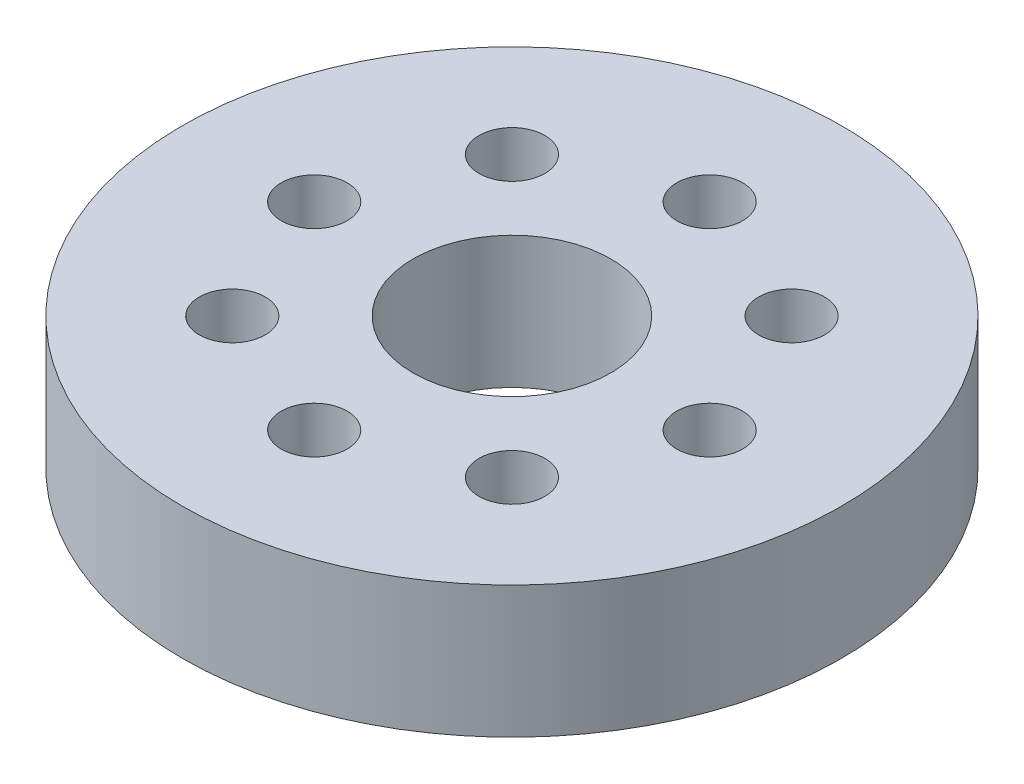
from build123d import *

# Parameters (mm, degrees)
SKETCH2_R           = 10
SKETCH2_R_2         = 3
SKETCH2_R_3         = 1
BOSS_EXTRUDE1_DEPTH = 4


with BuildPart() as part:
    # Sketch2 → Boss-Extrude1 (new body)
    with BuildSketch(Plane(origin=(0, 0, 0), x_dir=(1, 0, 0), z_dir=(0, 1, 0))):
        with Locations(Location((0, 0, 0), (0, 0, 270))):
            Circle(SKETCH2_R)
        with Locations(Location((0, 0, 0), (0, 0, 270))):
            Circle(SKETCH2_R_2, mode=Mode.SUBTRACT)
        with Locations(Location((0, 6, 0), (0, 0, 270))):
            Circle(SKETCH2_R_3, mode=Mode.SUBTRACT)
        with Locations(Location((4.242640687, 4.242640687, 0), (0, 0, 270))):
            Circle(SKETCH2_R_3, mode=Mode.SUBTRACT)
        with Locations(Location((6, 0, 0), (0, 0, 270))):
            Circle(SKETCH2_R_3, mode=Mode.SUBTRACT)
        with Locations(Location((4.242640687, -4.242640687, 0), (0, 0, 270))):
            Circle(SKETCH2_R_3, mode=Mode.SUBTRACT)
        with Locations(Location((0, -6, 0), (0, 0, 270))):
            Circle(SKETCH2_R_3, mode=Mode.SUBTRACT)
        with Locations(Location((-4.242640687, -4.242640687, 0), (0, 0, 270))):
            Circle(SKETCH2_R_3, mode=Mode.SUBTRACT)
        with Locations(Location((-6, 0, 0), (0, 0, 270))):
            Circle(SKETCH2_R_3, mode=Mode.SUBTRACT)
        with Locations(Location((-4.242640687, 4.242640687, 0), (0, 0, 270))):
            Circle(SKETCH2_R_3, mode=Mode.SUBTRACT)
    extrude(amount=BOSS_EXTRUDE1_DEPTH)


solid = part.part
